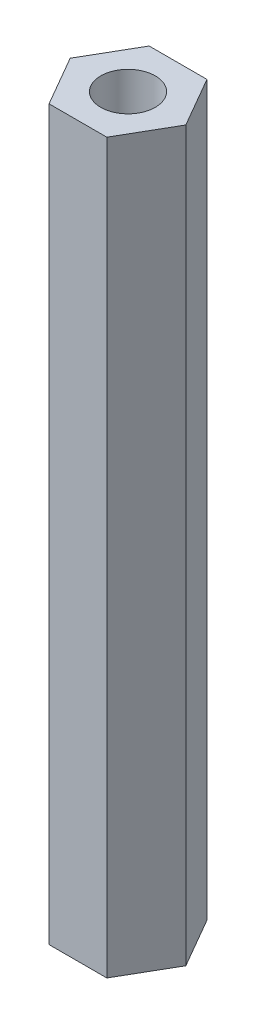
from build123d import *

# Parameters (mm, degrees)
SKETCH_1_R      = 1.5
EXTRUDE_1_DEPTH = 40


with BuildPart() as part:
    # 草图1 → 凸台-拉伸1 (new body)
    with BuildSketch(Plane(origin=(0, 0, 0), x_dir=(1, 0, 0), z_dir=(0, 1, 0))):
        Polygon((3.175426481, 0), (1.58771324, 2.75), (-1.58771324, 2.75), (-3.175426481, 0), (-1.58771324, -2.75), (1.58771324, -2.75), align=None)
        with Locations(Location((0, 0, 0), (0, 0, 270))):
            Circle(SKETCH_1_R, mode=Mode.SUBTRACT)
    extrude(amount=EXTRUDE_1_DEPTH)


solid = part.part
